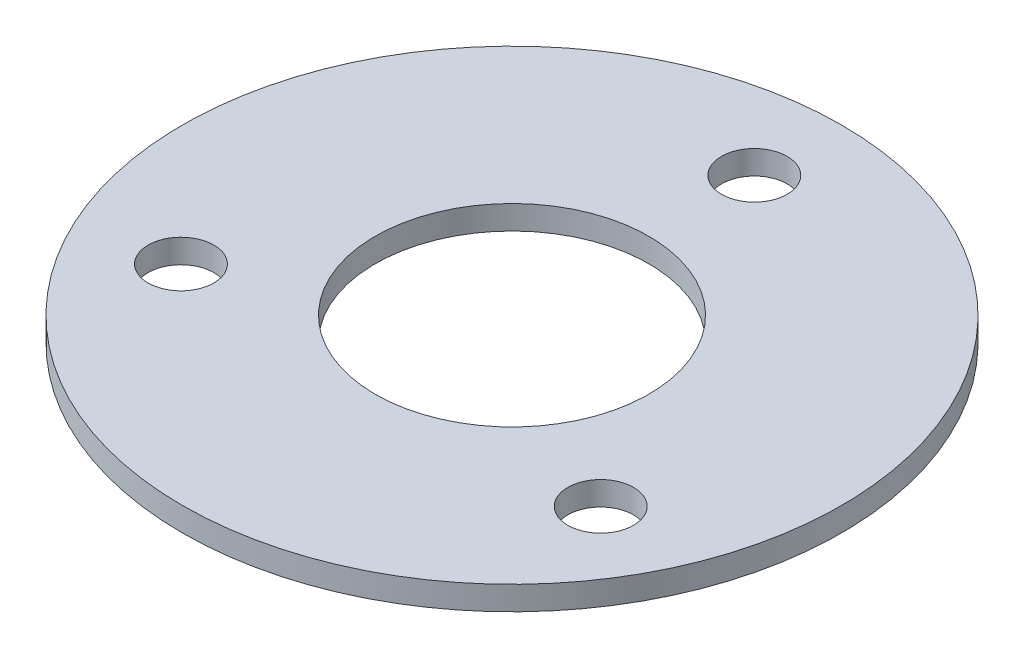
from build123d import *

# Parameters (mm, degrees)
SKETCH1_R           = 21.59
SKETCH1_R_2         = 8.9662
SKETCH1_R_3         = 2.15265
BOSS_EXTRUDE1_DEPTH = 1.5621


with BuildPart() as part:
    # Sketch1 → Boss-Extrude1 (new body)
    with BuildSketch(Plane(origin=(0, 0, 0), x_dir=(1, 0, 0), z_dir=(0, 1, 0))):
        with Locations(Location((0, 0, 0), (0, 0, 270))):
            Circle(SKETCH1_R)
        with Locations(Location((0, 0, 0), (0, 0, 270))):
            Circle(SKETCH1_R_2, mode=Mode.SUBTRACT)
        with Locations(Location((0, 15.875, 0), (0, 0, 270))):
            Circle(SKETCH1_R_3, mode=Mode.SUBTRACT)
        with Locations(Location((13.748153285, -7.9375, 0), (0, 0, 270))):
            Circle(SKETCH1_R_3, mode=Mode.SUBTRACT)
        with Locations(Location((-13.748153285, -7.9375, 0), (0, 0, 270))):
            Circle(SKETCH1_R_3, mode=Mode.SUBTRACT)
    extrude(amount=BOSS_EXTRUDE1_DEPTH)


solid = part.part
